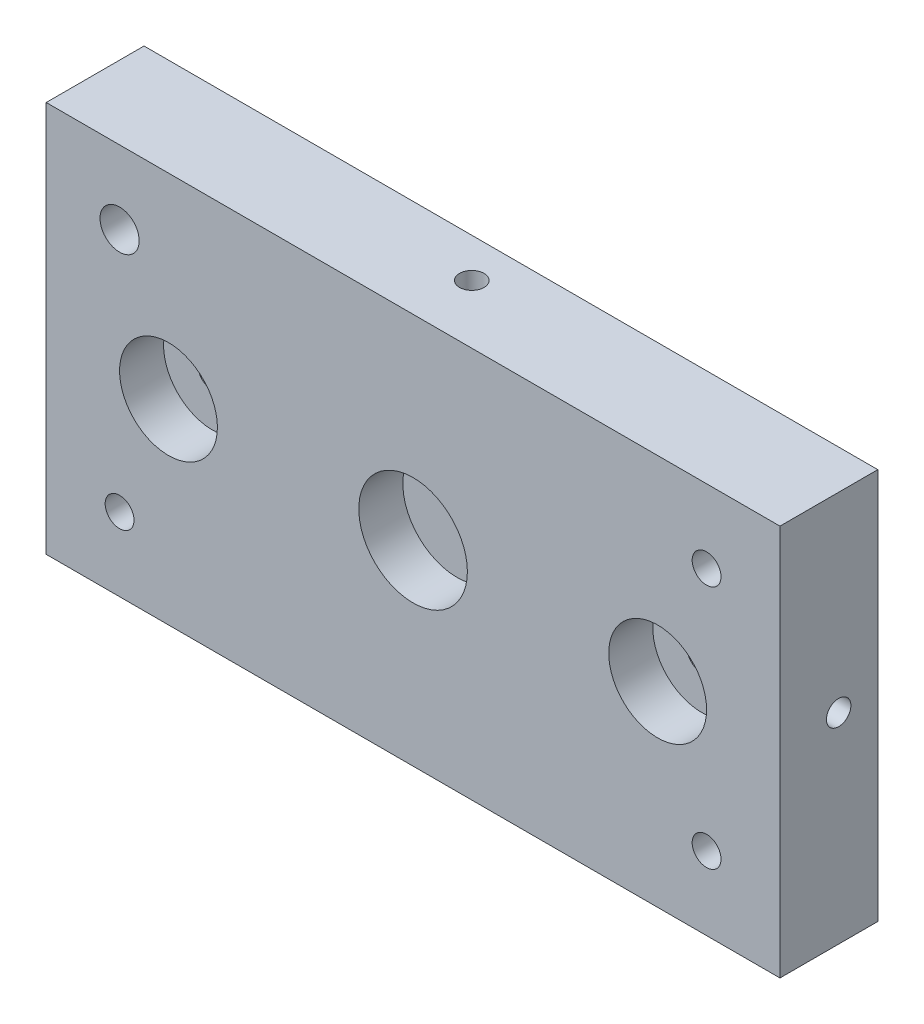
from build123d import *

# Parameters (mm, degrees)
SKETCH1_W           = 150
SKETCH1_H           = 80
BOSS_EXTRUDE1_DEPTH = 20
CUT_EXTRUDE1_REACH  = 89.321
SKETCH2_R           = 3
SKETCH3_R           = 11.1
SKETCH3_R_2         = 10
CUT_EXTRUDE2_DEPTH  = 9
CUT_EXTRUDE3_REACH  = 89.321
SKETCH4_R           = 4
SKETCH4_R_2         = 2.949605035
SKETCH5_R           = 5
CUT_EXTRUDE4_DEPTH  = 5
SKETCH6_R           = 2.5
CUT_EXTRUDE5_DEPTH  = 10
SKETCH7_R           = 2.5
CUT_EXTRUDE6_DEPTH  = 10
SKETCH8_R           = 2.5
CUT_EXTRUDE7_DEPTH  = 10


with BuildPart() as part:
    # Sketch1 → Boss-Extrude1 (new body)
    with BuildSketch(Plane.XY):
        Rectangle(SKETCH1_W, SKETCH1_H)
    extrude(amount=BOSS_EXTRUDE1_DEPTH)

    # Sketch2 → Cut-Extrude1 (cut, up to next)
    with BuildSketch(Plane.XY.offset(20), mode=Mode.PRIVATE) as cut_extrude1_sk1:
        with Locations((-50, 0)):
            Circle(SKETCH2_R)
    cut_extrude1_tool1 = extrude(cut_extrude1_sk1.sketch, amount=-CUT_EXTRUDE1_REACH, mode=Mode.PRIVATE) & part.part
    # Sketch2 → Cut-Extrude1 (cut, up to next)
    with BuildSketch(Plane.XY.offset(20), mode=Mode.PRIVATE) as cut_extrude1_sk2:
        with Locations((50, 0)):
            Circle(SKETCH2_R)
    cut_extrude1_tool2 = extrude(cut_extrude1_sk2.sketch, amount=-CUT_EXTRUDE1_REACH, mode=Mode.PRIVATE) & part.part
    add(cut_extrude1_tool1.solids().sort_by_distance((-50, 0, 20))[0], mode=Mode.SUBTRACT)
    add(cut_extrude1_tool2.solids().sort_by_distance((50, 0, 20))[0], mode=Mode.SUBTRACT)

    # Sketch3 → Cut-Extrude2 (cut)
    with BuildSketch(Plane.XY.offset(20)):
        Circle(SKETCH3_R)
        with Locations((-50, 0)):
            Circle(SKETCH3_R_2)
        with Locations((50, 0)):
            Circle(SKETCH3_R_2)
    extrude(amount=-CUT_EXTRUDE2_DEPTH, mode=Mode.SUBTRACT)

    # Sketch4 → Cut-Extrude3 (cut, up to next)
    with BuildSketch(Plane.XY.offset(20), mode=Mode.PRIVATE) as cut_extrude3_sk1:
        with Locations((-60, 25)):
            Circle(SKETCH4_R)
    cut_extrude3_tool1 = extrude(cut_extrude3_sk1.sketch, amount=-CUT_EXTRUDE3_REACH, mode=Mode.PRIVATE) & part.part
    # Sketch4 → Cut-Extrude3 (cut, up to next)
    with BuildSketch(Plane.XY.offset(20), mode=Mode.PRIVATE) as cut_extrude3_sk2:
        with Locations((60, 25)):
            Circle(SKETCH4_R_2)
    cut_extrude3_tool2 = extrude(cut_extrude3_sk2.sketch, amount=-CUT_EXTRUDE3_REACH, mode=Mode.PRIVATE) & part.part
    # Sketch4 → Cut-Extrude3 (cut, up to next)
    with BuildSketch(Plane.XY.offset(20), mode=Mode.PRIVATE) as cut_extrude3_sk3:
        with Locations((60, -25)):
            Circle(SKETCH4_R_2)
    cut_extrude3_tool3 = extrude(cut_extrude3_sk3.sketch, amount=-CUT_EXTRUDE3_REACH, mode=Mode.PRIVATE) & part.part
    # Sketch4 → Cut-Extrude3 (cut, up to next)
    with BuildSketch(Plane.XY.offset(20), mode=Mode.PRIVATE) as cut_extrude3_sk4:
        with Locations((-60, -25)):
            Circle(SKETCH4_R_2)
    cut_extrude3_tool4 = extrude(cut_extrude3_sk4.sketch, amount=-CUT_EXTRUDE3_REACH, mode=Mode.PRIVATE) & part.part
    add(cut_extrude3_tool1.solids().sort_by_distance((-60, 25, 20))[0], mode=Mode.SUBTRACT)
    add(cut_extrude3_tool2.solids().sort_by_distance((60, 25, 20))[0], mode=Mode.SUBTRACT)
    add(cut_extrude3_tool3.solids().sort_by_distance((60, -25, 20))[0], mode=Mode.SUBTRACT)
    add(cut_extrude3_tool4.solids().sort_by_distance((-60, -25, 20))[0], mode=Mode.SUBTRACT)

    # Sketch5 → Cut-Extrude4 (cut)
    with BuildSketch(Plane(origin=(0, 0, 0), x_dir=(-1, 0, 0), z_dir=(0, 0, -1))):
        with Locations((-50, 0)):
            Circle(SKETCH5_R)
        with Locations((50, 0)):
            Circle(SKETCH5_R)
    extrude(amount=-CUT_EXTRUDE4_DEPTH, mode=Mode.SUBTRACT)

    # Sketch6 → Cut-Extrude5 (cut)
    with BuildSketch(Plane.ZY.offset(75)):
        with Locations((8, 1)):
            Circle(SKETCH6_R)
    cut_extrude5 = extrude(amount=-CUT_EXTRUDE5_DEPTH, mode=Mode.SUBTRACT)

    # Mirror1: Cut-Extrude5 across plane
    add(cut_extrude5.mirror(Plane(origin=(0, 0, 0), x_dir=(0, 0, 1), z_dir=(1, 0, 0))), mode=Mode.SUBTRACT)

    # Sketch7 → Cut-Extrude6 (cut)
    with BuildSketch(Plane.XZ.offset(40)):
        with Locations((-62, 8)):
            Circle(SKETCH7_R)
        with Locations(Location((62, 8, 0), (0, 0, 180))):
            Circle(SKETCH7_R)
    extrude(amount=-CUT_EXTRUDE6_DEPTH, mode=Mode.SUBTRACT)

    # Sketch8 → Cut-Extrude7 (cut)
    with BuildSketch(Plane(origin=(0, 40, 0), x_dir=(1, 0, 0), z_dir=(0, 1, 0))):
        with Locations(Location((0, -8, 0), (0, 0, 180))):
            Circle(SKETCH8_R)
    extrude(amount=-CUT_EXTRUDE7_DEPTH, mode=Mode.SUBTRACT)


solid = part.part
